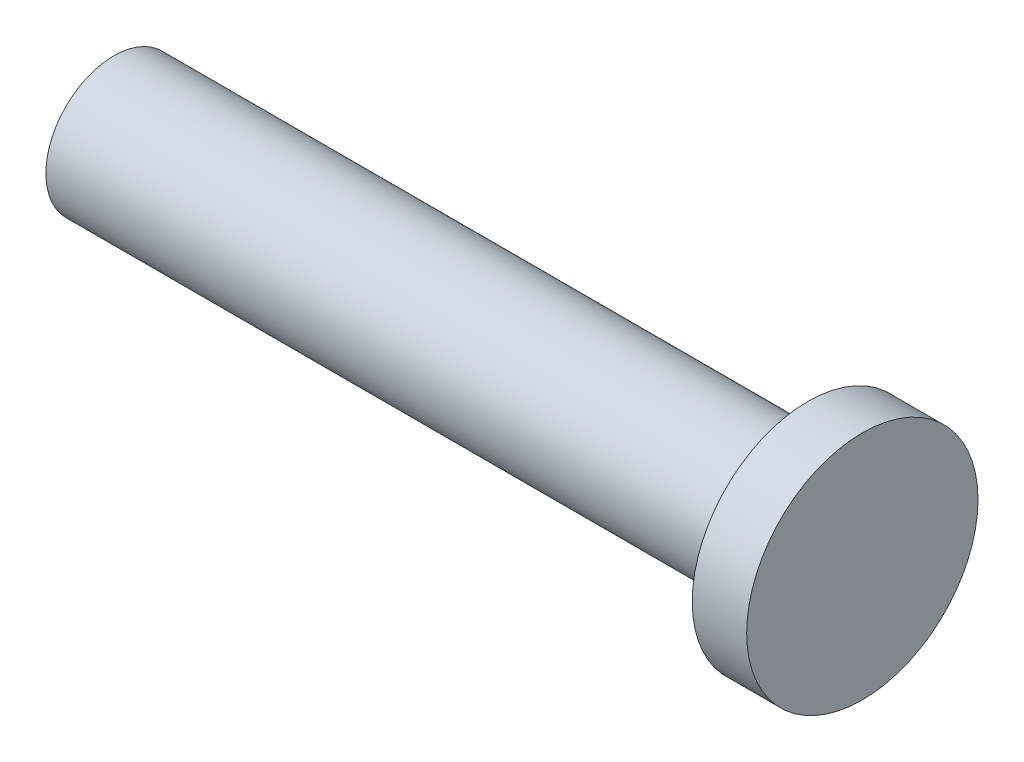
from build123d import *

# Parameters (mm, degrees)
SKETCH1_R           = 2.5
BOSS_EXTRUDE1_DEPTH = 27.5
BOSS_EXTRUDE2_START = -2
SKETCH2_R           = 4.25
SKETCH2_R_2         = 2.5
BOSS_EXTRUDE2_DEPTH = 2
SCALE1_SCALE        = 1.5


with BuildPart() as part:
    # Sketch1 → Boss-Extrude1 (new body)
    with BuildSketch(Plane(origin=(0, 0, 0), x_dir=(0, 0, -1), z_dir=(1, 0, 0))):
        Circle(SKETCH1_R)
    extrude(amount=BOSS_EXTRUDE1_DEPTH)

    # Sketch2 → Boss-Extrude2 (add)
    with BuildSketch(Plane(origin=(27.5, 0, 0), x_dir=(0, 0, -1), z_dir=(1, 0, 0)).offset(BOSS_EXTRUDE2_START)):
        Circle(SKETCH2_R)
        Circle(SKETCH2_R_2, mode=Mode.SUBTRACT)
    extrude(amount=BOSS_EXTRUDE2_DEPTH)


with BuildPart() as part_1:
    # Scale1: scaled about (15.29076087, 0, 0)
    add(part.part.scale(SCALE1_SCALE).moved(Location((-7.645380435, 0, 0))))


solid = part_1.part
